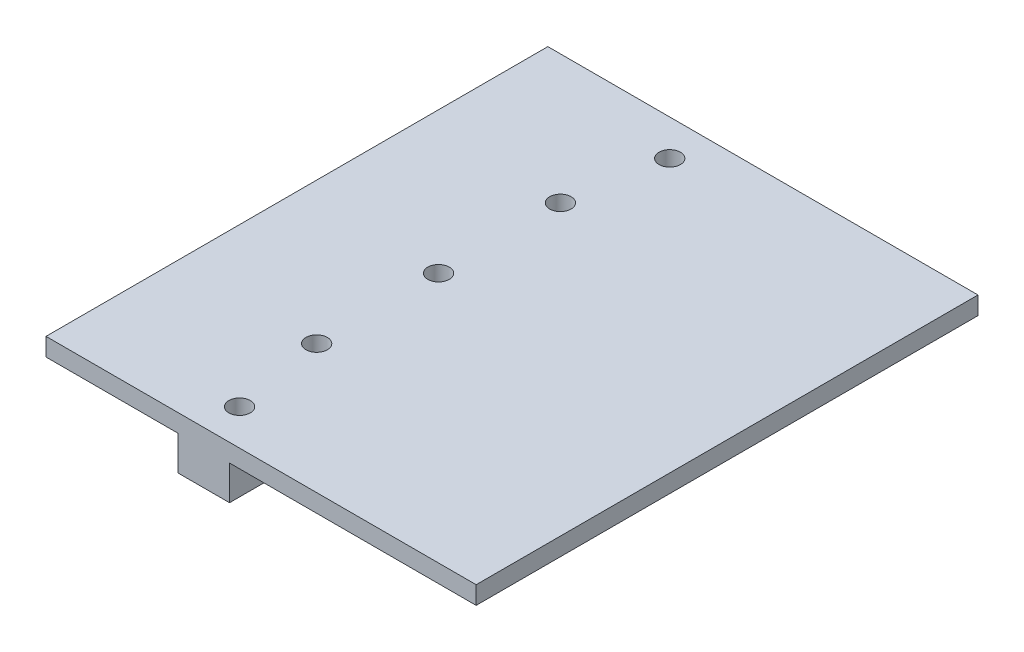
from build123d import *

# Parameters (mm, degrees)
SKETCH1_W             = 76.2
SKETCH1_H             = 88.9
BOSS_EXTRUDE1_DEPTH   = 3.175
SKETCH4_W             = 9.144
SKETCH4_H             = 88.9
BOSS_EXTRUDE2_DEPTH   = 6.096
F_6_CLEARANCE_HOLE1_D = 3.7973
SKETCH5_R             = 5.08
BOSS_EXTRUDE3_DEPTH   = 6.096
F_6_CLEARANCE_HOLE2_D = 3.7973


with BuildPart() as part:
    # Sketch1 → Boss-Extrude1 (new body)
    with BuildSketch(Plane(origin=(0, 0, 0), x_dir=(1, 0, 0), z_dir=(0, 1, 0))):
        Rectangle(SKETCH1_W, SKETCH1_H)
    extrude(amount=BOSS_EXTRUDE1_DEPTH)

    # Sketch4 → Boss-Extrude2 (add)
    with BuildSketch(Plane.XZ):
        with Locations((-10.16, 0)):
            Rectangle(SKETCH4_W, SKETCH4_H)
    extrude(amount=BOSS_EXTRUDE2_DEPTH)

    # #6 Clearance Hole1 (through all)
    with Locations(Plane(origin=(-10.16, 3.175, -38.1), x_dir=(0, 0, 1), z_dir=(0, 1, 0))):
        with Locations((0, 0), (76.2, 0)):
            Hole(F_6_CLEARANCE_HOLE1_D / 2)

    # Sketch5 → Boss-Extrude3 (add)
    with BuildSketch(Plane.XZ.offset(6.096)):
        with Locations((-13.01496, 0)):
            Circle(SKETCH5_R)
        with Locations((-13.01496, 21.59)):
            Circle(SKETCH5_R)
        with Locations((-13.01496, -21.59)):
            Circle(SKETCH5_R)
    extrude(amount=-BOSS_EXTRUDE3_DEPTH)

    # #6 Clearance Hole2 (through all)
    with Locations(Plane(origin=(-13.01496, 3.175, 0), x_dir=(0, 0, 1), z_dir=(0, 1, 0))):
        with Locations((0, 0), (-21.59, 0), (21.59, 0)):
            Hole(F_6_CLEARANCE_HOLE2_D / 2)


solid = part.part
